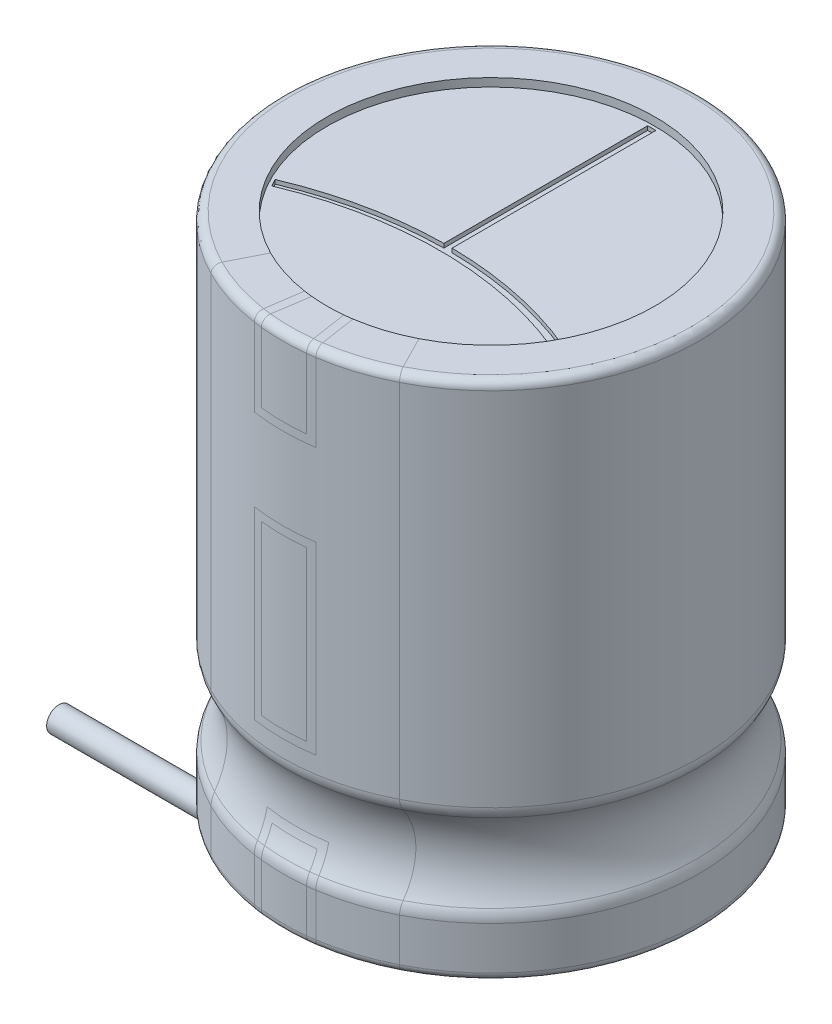
from build123d import *

# Parameters (mm, degrees)
SZKIC2_R                    = 4
WYTNIJ_WYCI_GNI_CIE1_DEPTH  = 0.2
WYTNIJ_WYCI_GNI_CIE2_START  = -0.8
SZKIC3_R                    = 4
WYTNIJ_WYCI_GNI_CIE2_DEPTH  = 0.8
WYTNIJ_WYCI_GNI_CIE3_DEPTH  = 0.1
DODANIE_WYCI_GNI_CIE3_DEPTH = 1.2
SZYK_KO_OWY1_COUNT          = 2
SZKIC13_R                   = 3
SZKIC13_R_2                 = 2.5
WYTNIJ_WYCI_GNI_CIE4_DEPTH  = 0.6
SZKIC11_R                   = 0.3


with BuildPart() as part:
    # Szkic1 → Obrót1 (revolve)
    with BuildSketch(Plane(origin=(0, 0, 0), x_dir=(0, 0, -1), z_dir=(1, 0, 0)), mode=Mode.PRIVATE) as obr_t1_sk:
        with BuildLine():
            Line((0, 0), (4.88, 0))
            ThreePointArc((4.88, 0), (5.021421356, 0.058578644), (5.08, 0.2))
            Line((5.08, 0.2), (5.08, 1.247502556))
            ThreePointArc((5.08, 1.247502556), (5.060687639, 1.385123027), (5.004242424, 1.512112393))
            ThreePointArc((5.004242424, 1.512112393), (4.73, 2.47), (5.004242424, 3.427887607))
            ThreePointArc((5.004242424, 3.427887607), (5.060687639, 3.554876973), (5.08, 3.692497444))
            Line((5.08, 3.692497444), (5.08, 12.5))
            ThreePointArc((5.08, 12.5), (5.021421356, 12.641421356), (4.88, 12.7))
            Line((4.88, 12.7), (0, 12.7))
            Line((0, 12.7), (0, 0))
        make_face()
    revolve(obr_t1_sk.sketch.rotate(Axis((0, 12.7, 0), (0, -1, 0)), 180), axis=Axis((0, 12.7, 0), (0, -1, 0)))

    # Szkic2 → Wytnij-wyciągnięcie1 (cut)
    with BuildSketch(Plane(origin=(0, 12.7, 0), x_dir=(1, 0, 0), z_dir=(0, 1, 0))):
        with Locations(Location((0, 0, 0), (0, 0, 270))):
            Circle(SZKIC2_R)
    extrude(amount=-WYTNIJ_WYCI_GNI_CIE1_DEPTH, mode=Mode.SUBTRACT)

    # Szkic3 → Wytnij-wyciągnięcie2 (cut)
    with BuildSketch(Plane.XZ.offset(WYTNIJ_WYCI_GNI_CIE2_START)):
        with Locations(Location((0, 0, 0), (0, 0, 90))):
            Circle(SZKIC3_R)
    extrude(amount=WYTNIJ_WYCI_GNI_CIE2_DEPTH, mode=Mode.SUBTRACT)

    # Szkic4 → Wytnij-wyciągnięcie3 (cut)
    with BuildSketch(Plane(origin=(0, 12.5, 0), x_dir=(1, 0, 0), z_dir=(0, 1, 0))):
        with BuildLine():
            Line((-0.1, 3.921857664), (-0.1, -1.049564655))
            ThreePointArc((-0.1, -1.049564655), (-1.838154548, -1.237887128), (-3.507540767, -1.757306264))
            ThreePointArc((-3.507540767, -1.757306264), (-3.461405184, -1.846521512), (-3.413000858, -1.934526475))
            ThreePointArc((-3.413000858, -1.934526475), (-1.740582206, -1.422084672), (0, -1.249011478))
            ThreePointArc((0, -1.249011478), (1.740582206, -1.422084672), (3.413000858, -1.934526475))
            ThreePointArc((3.413000858, -1.934526475), (3.461405184, -1.846521512), (3.507540767, -1.757306264))
            ThreePointArc((3.507540767, -1.757306264), (1.838154548, -1.237887128), (0.1, -1.049564655))
            Line((0.1, -1.049564655), (0.1, 3.921857664))
            ThreePointArc((0.1, 3.921857664), (0, 3.923132363), (-0.1, 3.921857664))
        make_face()
    extrude(amount=-WYTNIJ_WYCI_GNI_CIE3_DEPTH, mode=Mode.SUBTRACT)

    # Szkic12 → Dodanie-wyciągnięcie3 (add)
    with BuildSketch(Plane(origin=(0, 0.8, 0), x_dir=(-1, 0, 0), z_dir=(0, -1, 0))):
        with BuildLine():
            Line((1, -2.54), (1, -3.195700236))
            ThreePointArc((1, -3.195700236), (1.132538129, -3.444610906), (1.413043478, -3.473587213))
            ThreePointArc((1.413043478, -3.473587213), (2.916785903, -2.356875048), (3.6928538, -0.652173913))
            ThreePointArc((3.6928538, -0.652173913), (3.627264759, -0.407194624), (3.397425496, -0.3))
            Line((3.397425496, -0.3), (-3.397425496, -0.3))
            ThreePointArc((-3.397425496, -0.3), (-3.627264759, -0.407194624), (-3.6928538, -0.652173913))
            ThreePointArc((-3.6928538, -0.652173913), (-2.916785903, -2.356875048), (-1.413043478, -3.473587213))
            ThreePointArc((-1.413043478, -3.473587213), (-1.132538129, -3.444610906), (-1, -3.195700236))
            Line((-1, -3.195700236), (-1, -2.54))
            ThreePointArc((-1, -2.54), (0, -1.54), (1, -2.54))
        make_face()
    dodanie_wyci_gni_cie3 = extrude(amount=DODANIE_WYCI_GNI_CIE3_DEPTH)

    # Szyk kołowy1: Dodanie-wyciągnięcie3 ×2 about axis
    szyk_ko_owy1_axis = Axis((0, 0, 0), (0, 1, 0))
    for i in range(1, SZYK_KO_OWY1_COUNT):
        add(dodanie_wyci_gni_cie3.rotate(szyk_ko_owy1_axis, i * 360 / SZYK_KO_OWY1_COUNT))

    # Szkic13 → Wytnij-wyciągnięcie4 (cut)
    with BuildSketch(Plane(origin=(0, -0.4, 0), x_dir=(-1, 0, 0), z_dir=(0, -1, 0))):
        Circle(SZKIC13_R)
        Circle(SZKIC13_R_2, mode=Mode.SUBTRACT)
    extrude(amount=-WYTNIJ_WYCI_GNI_CIE4_DEPTH, mode=Mode.SUBTRACT)

    # По траектории2: sweep along a path in Эскиз1
    with BuildLine(Plane.XY) as sweep_2_path:
        Line((0, 0.8), (0, 0.25))
        ThreePointArc((0, 0.25), (-0.292893219, -0.457106781), (-1, -0.75))
        Line((-1, -0.75), (-8, -0.75))
    # Szkic11 → По траектории2 (sweep)
    with BuildSketch(Plane(origin=(0, 0.8, 0), x_dir=(-1, 0, 0), z_dir=(0, -1, 0))):
        with Locations((0, -2.54)):
            Circle(SZKIC11_R)
        with Locations((0, 2.54)):
            Circle(SZKIC11_R)
    sweep(path=sweep_2_path.line)


solid = part.part
